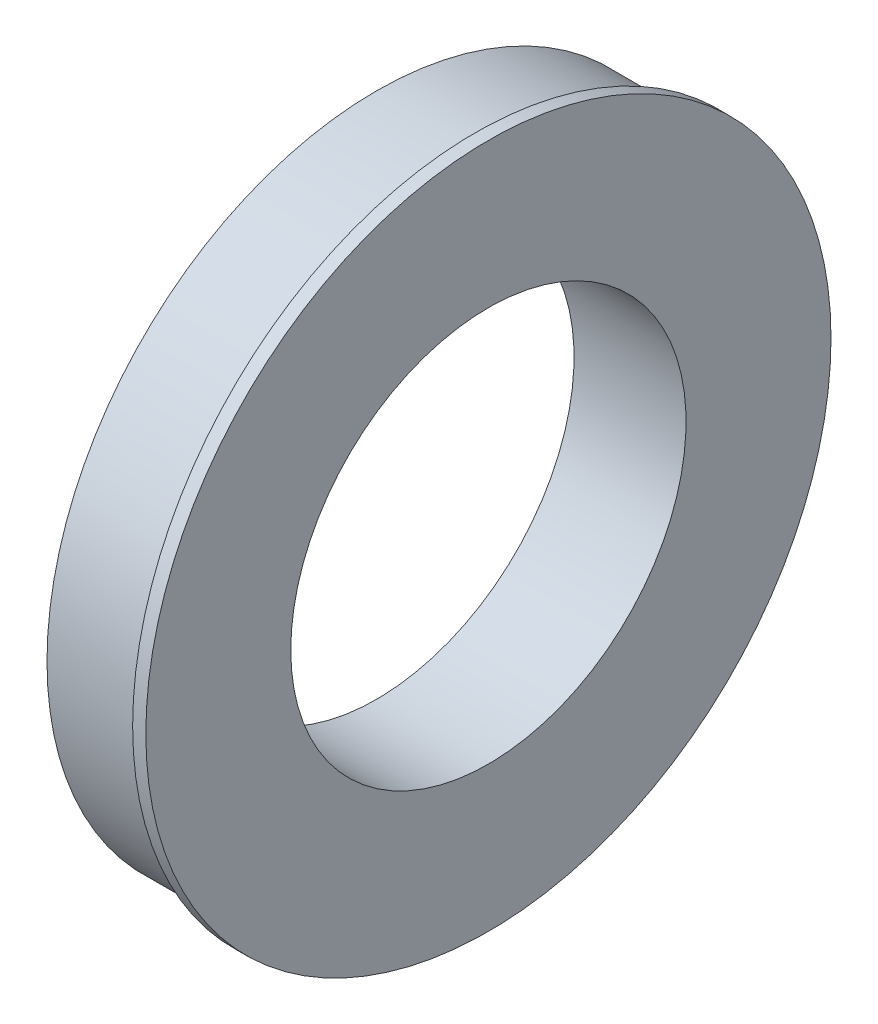
from build123d import *

# Parameters (mm, degrees)
SKETCH1_R           = 63.5
SKETCH1_R_2         = 38.1
BOSS_EXTRUDE1_DEPTH = 19.05
SKETCH2_R           = 66.04
SKETCH2_R_2         = 38.1
BOSS_EXTRUDE2_DEPTH = 2.54
SCALE1_SCALE        = 0.51948


with BuildPart() as part:
    # Sketch1 → Boss-Extrude1 (new body)
    with BuildSketch(Plane(origin=(0, 0, 0), x_dir=(0, 0, -1), z_dir=(1, 0, 0))):
        with Locations(Location((0, 0, 0), (0, 0, 180))):
            Circle(SKETCH1_R)
        with Locations(Location((0, 0, 0), (0, 0, 180))):
            Circle(SKETCH1_R_2, mode=Mode.SUBTRACT)
    extrude(amount=BOSS_EXTRUDE1_DEPTH)

    # Sketch2 → Boss-Extrude2 (add)
    with BuildSketch(Plane(origin=(19.05, 0, 0), x_dir=(0, 0, -1), z_dir=(1, 0, 0))):
        Circle(SKETCH2_R)
        with Locations(Location((0, 0, 0), (0, 0, 180))):
            Circle(SKETCH2_R_2, mode=Mode.SUBTRACT)
    extrude(amount=BOSS_EXTRUDE2_DEPTH)


with BuildPart() as part_1:
    # Scale1: scaled about (10.935763547, 0, 0)
    add(part.part.scale(SCALE1_SCALE).moved(Location((5.2548531, 0, 0))))


solid = part_1.part
